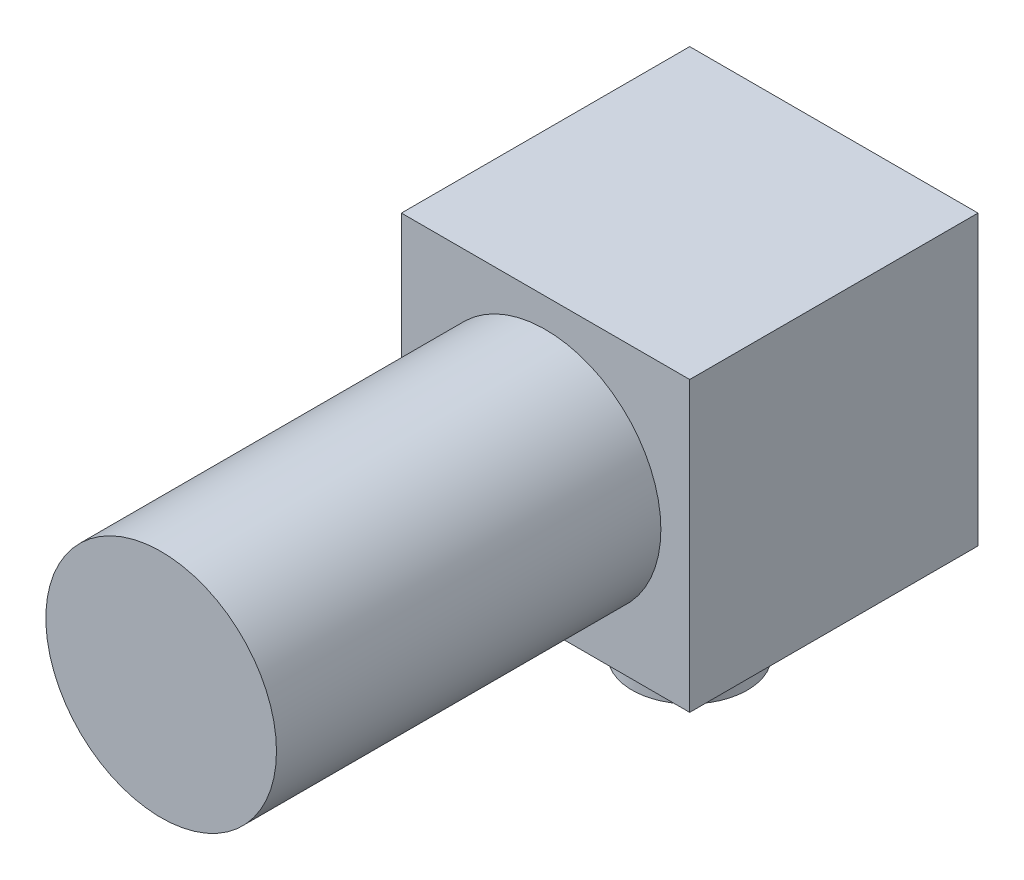
from build123d import *

# Parameters (mm, degrees)
SKETCH1_W           = 15
SKETCH1_H           = 15
BOSS_EXTRUDE1_DEPTH = 15
SKETCH2_R           = 6
BOSS_EXTRUDE2_DEPTH = 20
SKETCH3_R           = 6
CUT_EXTRUDE1_DEPTH  = 10
SKETCH4_R           = 3
BOSS_EXTRUDE3_DEPTH = 5


with BuildPart() as part:
    # Sketch1 → Boss-Extrude1 (new body)
    with BuildSketch(Plane.XY):
        Rectangle(SKETCH1_W, SKETCH1_H)
    extrude(amount=BOSS_EXTRUDE1_DEPTH)

    # Sketch2 → Boss-Extrude2 (add)
    with BuildSketch(Plane.XY.offset(15)):
        Circle(SKETCH2_R)
    extrude(amount=BOSS_EXTRUDE2_DEPTH)

    # Sketch3 → Cut-Extrude1 (cut)
    with BuildSketch(Plane(origin=(0, 0, 0), x_dir=(-1, 0, 0), z_dir=(0, 0, -1))):
        with Locations(Location((0, 0, 0), (0, 0, 180))):
            Circle(SKETCH3_R)
    extrude(amount=-CUT_EXTRUDE1_DEPTH, mode=Mode.SUBTRACT)

    # Sketch4 → Boss-Extrude3 (add)
    with BuildSketch(Plane.XZ.offset(7.5)):
        with Locations(Location((0, 7.5, 0), (0, 0, 270))):
            Circle(SKETCH4_R)
    extrude(amount=BOSS_EXTRUDE3_DEPTH)


solid = part.part
